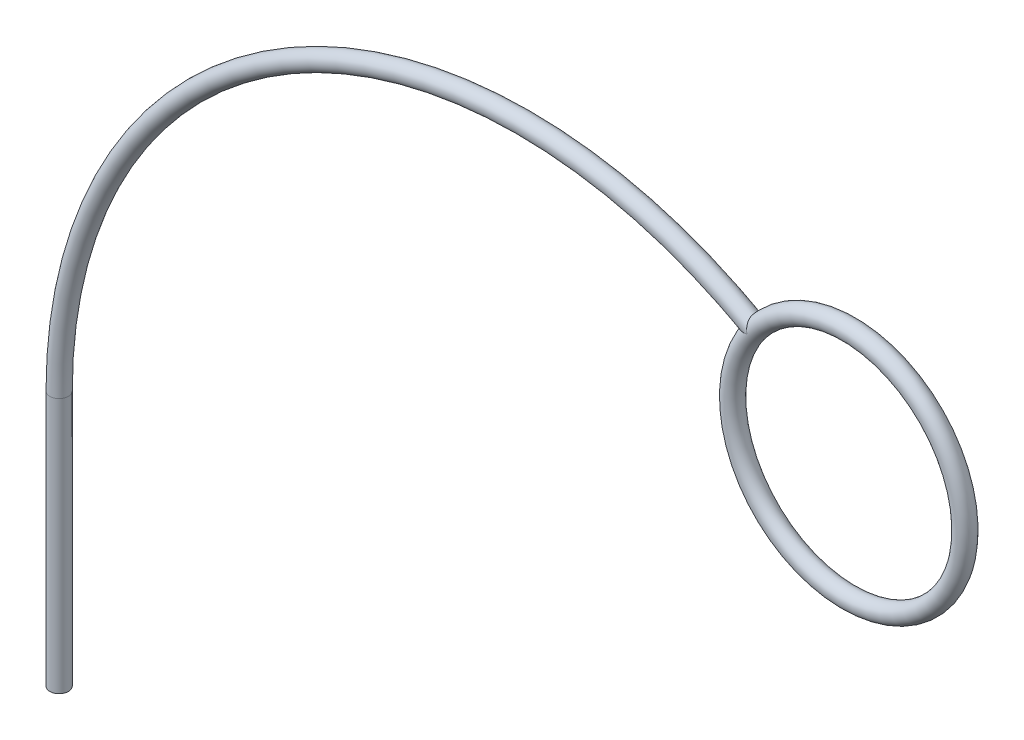
from build123d import *

# Parameters (mm, degrees)
SKETCH2_R = 0.4
SKETCH3_R = 0.4


with BuildPart() as part:
    # Sweep4: sweep along a path in Sketch1
    with BuildLine(Plane.XY) as sweep4_path:
        Line((-1.718442937, -7.375333855), (-1.718442937, 3.624666145))
        ThreePointArc((-1.718442937, 3.624666145), (8.281557063, 20.94517422), (28.281557063, 20.94517422))
    # Sketch2 → Sweep4 (sweep)
    with BuildSketch(Plane(origin=(-1.718442937, -7.375333855, 0), x_dir=(1, 0, 0), z_dir=(0, 1, 0))):
        Circle(SKETCH2_R)
    sweep(path=sweep4_path.line)

    # Sweep5: sweep along a path in Sketch4
    with BuildLine(Plane.XY) as sweep5_path:
        CenterArc((32.265221777, 17.923516489), 5, 0, 360)
    # Sketch3 → Sweep5 (sweep)
    with BuildSketch(Plane(origin=(28.281557063, 20.94517422, 0), x_dir=(-0.7967329428042198, 0.6043315462976658, 0), z_dir=(-0.6043315462976658, -0.7967329428042198, 0))):
        Circle(SKETCH3_R)
    sweep(path=sweep5_path.line)


solid = part.part
